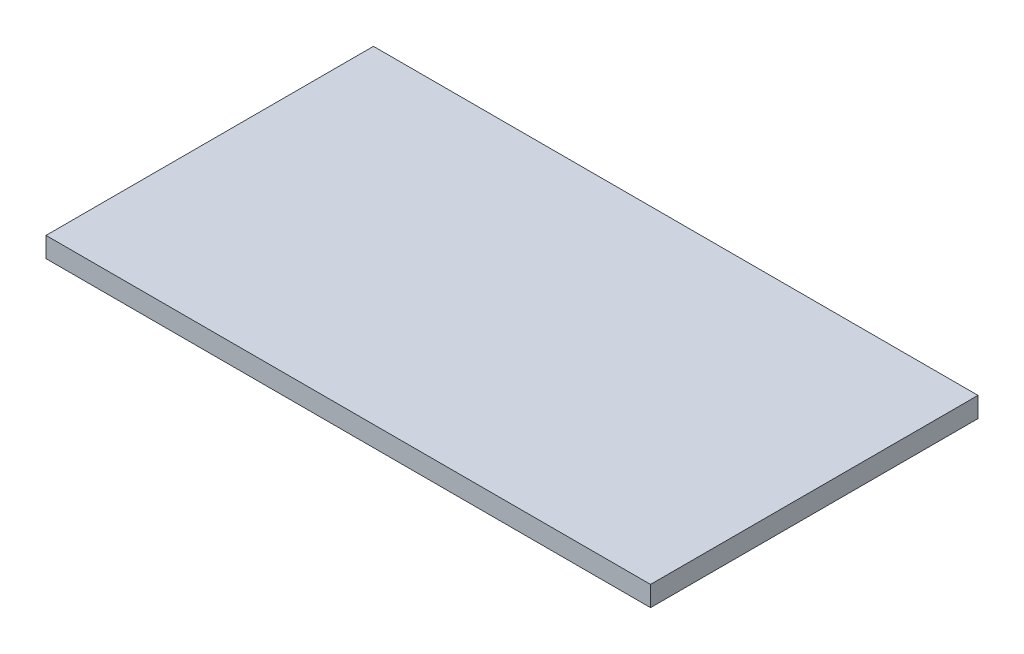
from build123d import *

# Parameters (mm, degrees)
FACE_PLATE_W         = 120
FACE_PLATE_H         = 65
FACE_PLATE_EXT_DEPTH = 4


with BuildPart() as part:
    # Face Plate → Face Plate Ext (new body)
    with BuildSketch(Plane(origin=(0, 0, 0), x_dir=(1, 0, 0), z_dir=(0, 1, 0))):
        Rectangle(FACE_PLATE_W, FACE_PLATE_H)
    extrude(amount=FACE_PLATE_EXT_DEPTH)


solid = part.part
